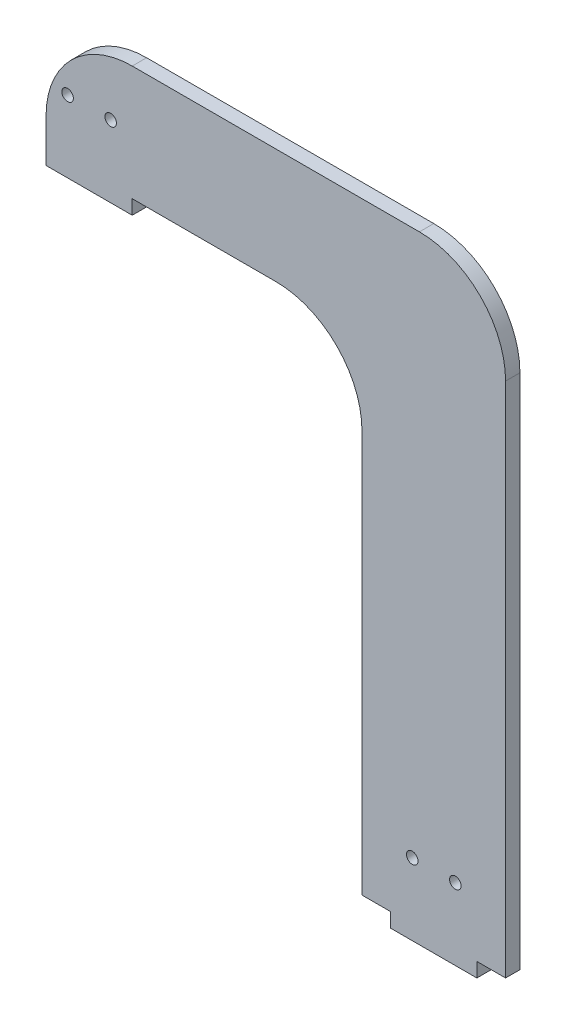
from build123d import *

# Parameters (mm, degrees)
SALIENTE_EXTRUIR1_DEPTH = 5
REDONDEO1_R             = 30
CORTAR_EXTRUIR1_REACH   = 264.202
CROQUIS2_R              = 2


with BuildPart() as part:
    # Croquis1 → Saliente-Extruir1 (new body)
    with BuildSketch(Plane.XY):
        Polygon((-30, 0), (0, 0), (0, 5), (10, 5), (10, 215), (-150, 215), (-150, 170), (-120, 170), (-120, 175), (-40, 175), (-40, 5), (-30, 5), align=None)
    extrude(amount=SALIENTE_EXTRUIR1_DEPTH)

    # Redondeo1
    redondeo1_edges = [part.edges().sort_by_distance(p)[0] for p in [
        (-40, 175, 2.5),
        (-150, 215, 2.5),
        (10, 215, 2.5),
    ]]
    fillet(redondeo1_edges, radius=REDONDEO1_R)

    # Croquis2 → Cortar-Extruir1 (cut, up to next)
    with BuildSketch(Plane.XY.offset(5), mode=Mode.PRIVATE) as cortar_extruir1_sk1:
        with Locations((-7.5, 25)):
            Circle(CROQUIS2_R)
    cortar_extruir1_tool1 = extrude(cortar_extruir1_sk1.sketch, amount=-CORTAR_EXTRUIR1_REACH, mode=Mode.PRIVATE) & part.part
    # Croquis2 → Cortar-Extruir1 (cut, up to next)
    with BuildSketch(Plane.XY.offset(5), mode=Mode.PRIVATE) as cortar_extruir1_sk2:
        with Locations((-22.5, 25)):
            Circle(CROQUIS2_R)
    cortar_extruir1_tool2 = extrude(cortar_extruir1_sk2.sketch, amount=-CORTAR_EXTRUIR1_REACH, mode=Mode.PRIVATE) & part.part
    # Croquis2 → Cortar-Extruir1 (cut, up to next)
    with BuildSketch(Plane.XY.offset(5), mode=Mode.PRIVATE) as cortar_extruir1_sk3:
        with Locations((-127.5, 195)):
            Circle(CROQUIS2_R)
    cortar_extruir1_tool3 = extrude(cortar_extruir1_sk3.sketch, amount=-CORTAR_EXTRUIR1_REACH, mode=Mode.PRIVATE) & part.part
    # Croquis2 → Cortar-Extruir1 (cut, up to next)
    with BuildSketch(Plane.XY.offset(5), mode=Mode.PRIVATE) as cortar_extruir1_sk4:
        with Locations((-142.5, 195)):
            Circle(CROQUIS2_R)
    cortar_extruir1_tool4 = extrude(cortar_extruir1_sk4.sketch, amount=-CORTAR_EXTRUIR1_REACH, mode=Mode.PRIVATE) & part.part
    add(cortar_extruir1_tool1.solids().sort_by_distance((-7.5, 25, 5))[0], mode=Mode.SUBTRACT)
    add(cortar_extruir1_tool2.solids().sort_by_distance((-22.5, 25, 5))[0], mode=Mode.SUBTRACT)
    add(cortar_extruir1_tool3.solids().sort_by_distance((-127.5, 195, 5))[0], mode=Mode.SUBTRACT)
    add(cortar_extruir1_tool4.solids().sort_by_distance((-142.5, 195, 5))[0], mode=Mode.SUBTRACT)


solid = part.part
